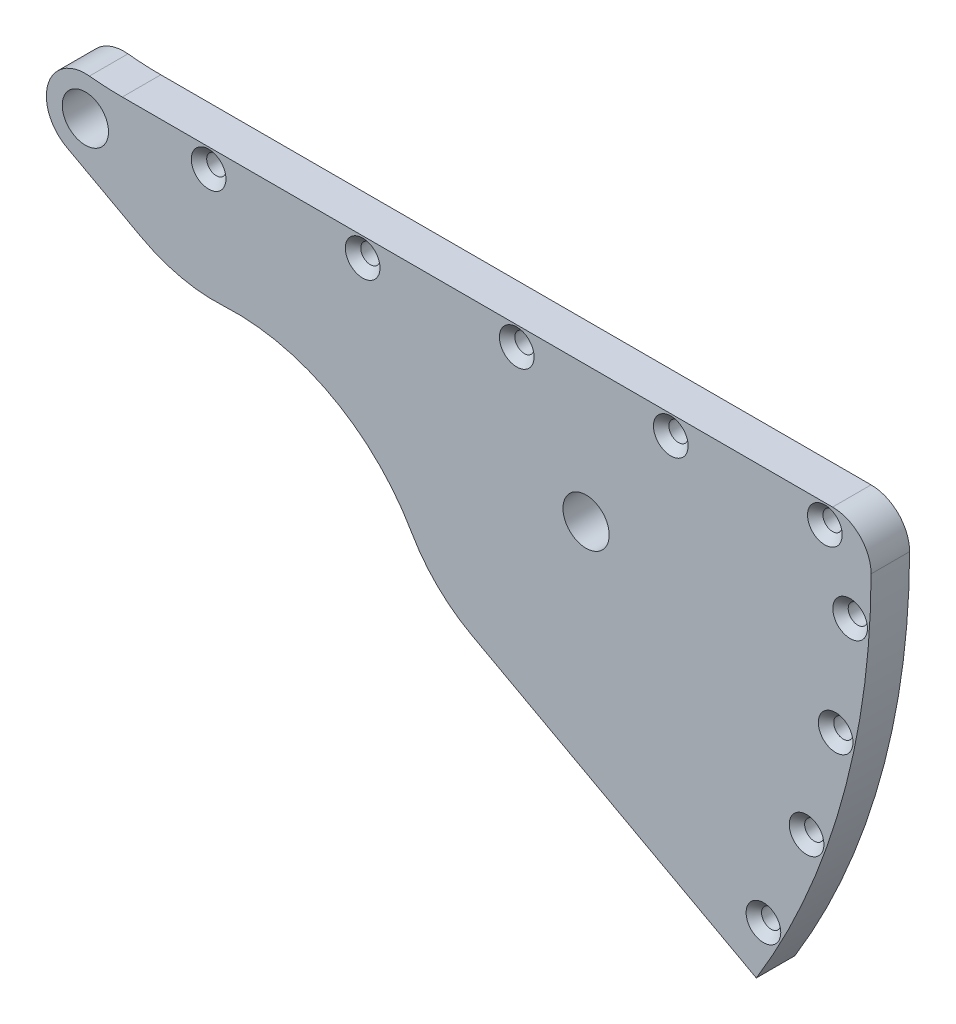
from build123d import *

# Parameters (mm, degrees)
SKETCH1_R                    = 3
BOSS_EXTRUDE1_DEPTH          = 10
SKETCH2_R                    = 6
CUT_EXTRUDE1_DEPTH           = 10
SKETCH3_R                    = 52.728139035
CUT_EXTRUDE2_DEPTH           = 10
FILLET1_R                    = 40
SKETCH4_R                    = 2.5
CUT_EXTRUDE3_DEPTH           = 10
CHAMFER1_SIZE                = 2
FILLET2_R                    = 10
LPATTERN3_COUNT              = 5
LPATTERN3_PITCH              = 40
CHAMFER1_OF_LPATTERN3_SIZE   = 2
SKETCH5_R                    = 2.5
CUT_EXTRUDE4_DEPTH           = 10
CHAMFER2_SIZE                = 2
CIRPATTERN2_COUNT            = 45
CHAMFER2_OF_CIRPATTERN2_SIZE = 2
FILLET4_R                    = 82


with BuildPart() as part:
    # Sketch1 → Boss-Extrude1 (new body)
    with BuildSketch(Plane.XY):
        with BuildLine():
            Line((134, -12.3683), (134, -2.7366))
            Line((134, -2.7366), (-66.856482862, -2.7366))
            ThreePointArc((-66.856482862, -2.7366), (-79.305955572, -8.361988007), (-74.83591229, -21.271406043))
            Line((-74.83591229, -21.271406043), (104.205340418, -118.521488224))
            ThreePointArc((104.205340418, -118.521488224), (120.331391511, -85.784656527), (130.366665775, -50.69843496))
            ThreePointArc((130.366665775, -50.69843496), (131.475070851, -44.365109618), (132.383339124, -38))
            ThreePointArc((132.383339124, -38), (133.595433619, -25.209616495), (134, -12.3683))
        make_face()
        with Locations((60, -38)):
            Circle(SKETCH1_R, mode=Mode.SUBTRACT)
        with Locations((-70, -12.3683)):
            Circle(SKETCH1_R, mode=Mode.SUBTRACT)
    extrude(amount=BOSS_EXTRUDE1_DEPTH)

    # Sketch2 → Cut-Extrude1 (cut)
    with BuildSketch(Plane.XY.offset(10)):
        with Locations((60, -38)):
            Circle(SKETCH2_R)
        with Locations((-70, -12.3683)):
            Circle(SKETCH2_R)
    extrude(amount=-CUT_EXTRUDE1_DEPTH, mode=Mode.SUBTRACT)

    # Sketch3 → Cut-Extrude2 (cut)
    with BuildSketch(Plane.XY.offset(10)):
        with Locations((-31.102013179, -89.20992017)):
            Circle(SKETCH3_R)
    extrude(amount=-CUT_EXTRUDE2_DEPTH, mode=Mode.SUBTRACT)

    # Fillet1
    fillet1_edges = [part.edges().sort_by_distance(p)[0] for p in [
        (18.78007916, -72.120932196, 5),
        (-43.920680471, -38.063674805, 5),
    ]]
    fillet(fillet1_edges, radius=FILLET1_R)

    # Sketch4 → Cut-Extrude3 (cut)
    with BuildSketch(Plane.XY.offset(10)):
        with Locations((122, -7.7366)):
            Circle(SKETCH4_R)
    cut_extrude3 = extrude(amount=-CUT_EXTRUDE3_DEPTH, mode=Mode.SUBTRACT)

    # Chamfer1
    chamfer1_edges = [part.edges().sort_by_distance(p)[0] for p in [
        (119.5, -7.7366, 10),
    ]]
    chamfer(chamfer1_edges, length=CHAMFER1_SIZE)

    # Fillet2
    fillet2_edges = [part.edges().sort_by_distance(p)[0] for p in [
        (134, -2.7366, 5),
    ]]
    fillet(fillet2_edges, radius=FILLET2_R)

    # LPattern3: Cut-Extrude3 ×5
    with Locations(*[(-i * LPATTERN3_PITCH, 0, 0) for i in range(1, LPATTERN3_COUNT)]):
        add(cut_extrude3, mode=Mode.SUBTRACT)

    # Chamfer1 of LPattern3
    chamfer1_of_lpattern3_edges = [part.edges().sort_by_distance(p)[0] for p in [
        (79.5, -7.7366, 10),
        (39.5, -7.7366, 10),
        (-0.5, -7.7366, 10),
        (-40.5, -7.7366, 10),
    ]]
    chamfer(chamfer1_of_lpattern3_edges, length=CHAMFER1_OF_LPATTERN3_SIZE)

    # Sketch5 → Cut-Extrude4 (cut)
    with BuildSketch(Plane.XY.offset(10)):
        with Locations((128.565543545, -25.510785173)):
            Circle(SKETCH5_R)
    cut_extrude4 = extrude(amount=-CUT_EXTRUDE4_DEPTH, mode=Mode.SUBTRACT)

    # Chamfer2
    chamfer2_edges = [part.edges().sort_by_distance(p)[0] for p in [
        (126.065543545, -25.510785173, 10),
    ]]
    chamfer(chamfer2_edges, length=CHAMFER2_SIZE)

    # CirPattern2: Cut-Extrude4 ×45 about axis, 41 skipped
    cirpattern2_axis = Axis((-70, -12.3683, 10), (0, 0, 1))
    add([cut_extrude4.rotate(cirpattern2_axis, i * 360 / CIRPATTERN2_COUNT) for i in range(1, CIRPATTERN2_COUNT) if i not in (1, 2, 3, 4, 5, 6, 7, 8, 9, 10, 11, 12, 13, 14, 15, 16, 17, 18, 19, 20, 21, 22, 23, 24, 25, 26, 27, 28, 29, 30, 31, 32, 33, 34, 35, 36, 37, 38, 39, 40, 41)], mode=Mode.SUBTRACT)

    # Chamfer2 of CirPattern2
    chamfer2_of_cirpattern2_edges = [part.edges().sort_by_distance(p)[0] for p in [
        (103.769256405, -104.121598636, 10),
        (114.847737042, -79.044655576, 10),
        (122.328366738, -52.669933097, 10),
    ]]
    chamfer(chamfer2_of_cirpattern2_edges, length=CHAMFER2_OF_CIRPATTERN2_SIZE)

    # Fillet4
    fillet4_edges = [part.edges().sort_by_distance(p)[0] for p in [
        (-66.856482862, -2.7366, 5),
    ]]
    fillet(fillet4_edges, radius=FILLET4_R)


solid = part.part
